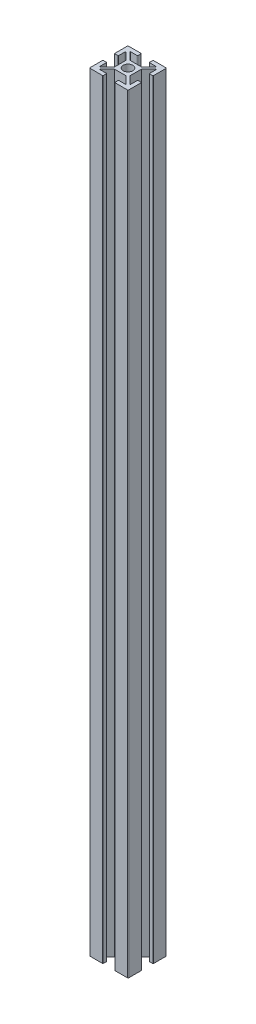
from build123d import *

# Parameters (mm, degrees)
SKETCH1_R           = 2.5
BOSS_EXTRUDE2_DEPTH = 400


with BuildPart() as part:
    # Sketch1 → Boss-Extrude2 (new body)
    with BuildSketch(Plane(origin=(0, 0, 0), x_dir=(1, 0, 0), z_dir=(0, 1, 0))):
        with BuildLine():
            Line((-9.896296296, 3), (-8.196296296, 3))
            ThreePointArc((-8.196296296, 3), (-8.090230279, 3.043933983), (-8.046296296, 3.15))
            Line((-8.046296296, 3.15), (-8.046296296, 6.586184513))
            ThreePointArc((-8.046296296, 6.586184513), (-7.954097251, 6.724600732), (-7.790842301, 6.692859041))
            Line((-7.790842301, 6.692859041), (-4, 2.945390222))
            Line((-4, 2.945390222), (-4, -2.945390222))
            Line((-4, -2.945390222), (-7.790842301, -6.692859041))
            ThreePointArc((-7.790842301, -6.692859041), (-7.954097251, -6.724600732), (-8.046296296, -6.586184513))
            Line((-8.046296296, -6.586184513), (-8.046296296, -3.15))
            ThreePointArc((-8.046296296, -3.15), (-8.090230279, -3.043933983), (-8.196296296, -3))
            Line((-8.196296296, -3), (-9.896296296, -3))
            ThreePointArc((-9.896296296, -3), (-10.002362313, -3.043933983), (-10.046296296, -3.15))
            Line((-10.046296296, -3.15), (-10.046296296, -9.65))
            ThreePointArc((-10.046296296, -9.65), (-9.94378367, -9.897487373), (-9.696296296, -10))
            Line((-9.696296296, -10), (-3.196296296, -10))
            ThreePointArc((-3.196296296, -10), (-3.090230279, -9.956066017), (-3.046296296, -9.85))
            Line((-3.046296296, -9.85), (-3.046296296, -8.15))
            ThreePointArc((-3.046296296, -8.15), (-3.090230279, -8.043933983), (-3.196296296, -8))
            Line((-3.196296296, -8), (-6.614381093, -8))
            ThreePointArc((-6.614381093, -8), (-6.753127587, -7.9070036), (-6.719835089, -7.743325472))
            Line((-6.719835089, -7.743325472), (-2.93318409, -4))
            Line((-2.93318409, -4), (2.93318409, -4))
            Line((2.93318409, -4), (6.719835089, -7.743325472))
            ThreePointArc((6.719835089, -7.743325472), (6.753127587, -7.9070036), (6.614381093, -8))
            Line((6.614381093, -8), (3.196296296, -8))
            ThreePointArc((3.196296296, -8), (3.090230279, -8.043933983), (3.046296296, -8.15))
            Line((3.046296296, -8.15), (3.046296296, -9.85))
            ThreePointArc((3.046296296, -9.85), (3.090230279, -9.956066017), (3.196296296, -10))
            Line((3.196296296, -10), (9.696296296, -10))
            ThreePointArc((9.696296296, -10), (9.94378367, -9.897487373), (10.046296296, -9.65))
            Line((10.046296296, -9.65), (10.046296296, -3.15))
            ThreePointArc((10.046296296, -3.15), (10.002362313, -3.043933983), (9.896296296, -3))
            Line((9.896296296, -3), (8.196296296, -3))
            ThreePointArc((8.196296296, -3), (8.090230279, -3.043933983), (8.046296296, -3.15))
            Line((8.046296296, -3.15), (8.046296296, -6.586184513))
            ThreePointArc((8.046296296, -6.586184513), (7.954097251, -6.724600732), (7.790842301, -6.692859041))
            Line((7.790842301, -6.692859041), (4, -2.945390222))
            Line((4, -2.945390222), (4, 2.945390222))
            Line((4, 2.945390222), (7.790842301, 6.692859041))
            ThreePointArc((7.790842301, 6.692859041), (7.954097251, 6.724600732), (8.046296296, 6.586184513))
            Line((8.046296296, 6.586184513), (8.046296296, 3.15))
            ThreePointArc((8.046296296, 3.15), (8.090230279, 3.043933983), (8.196296296, 3))
            Line((8.196296296, 3), (9.896296296, 3))
            ThreePointArc((9.896296296, 3), (10.002362313, 3.043933983), (10.046296296, 3.15))
            Line((10.046296296, 3.15), (10.046296296, 9.65))
            ThreePointArc((10.046296296, 9.65), (9.94378367, 9.897487373), (9.696296296, 10))
            Line((9.696296296, 10), (3.196296296, 10))
            ThreePointArc((3.196296296, 10), (3.090230279, 9.956066017), (3.046296296, 9.85))
            Line((3.046296296, 9.85), (3.046296296, 8.15))
            ThreePointArc((3.046296296, 8.15), (3.090230279, 8.043933983), (3.196296296, 8))
            Line((3.196296296, 8), (6.614381093, 8))
            ThreePointArc((6.614381093, 8), (6.753127587, 7.9070036), (6.719835089, 7.743325472))
            Line((6.719835089, 7.743325472), (2.93318409, 4))
            Line((2.93318409, 4), (-2.93318409, 4))
            Line((-2.93318409, 4), (-6.719835089, 7.743325472))
            ThreePointArc((-6.719835089, 7.743325472), (-6.753127587, 7.9070036), (-6.614381093, 8))
            Line((-6.614381093, 8), (-3.196296296, 8))
            ThreePointArc((-3.196296296, 8), (-3.090230279, 8.043933983), (-3.046296296, 8.15))
            Line((-3.046296296, 8.15), (-3.046296296, 9.85))
            ThreePointArc((-3.046296296, 9.85), (-3.090230279, 9.956066017), (-3.196296296, 10))
            Line((-3.196296296, 10), (-9.696296296, 10))
            ThreePointArc((-9.696296296, 10), (-9.94378367, 9.897487373), (-10.046296296, 9.65))
            Line((-10.046296296, 9.65), (-10.046296296, 3.15))
            ThreePointArc((-10.046296296, 3.15), (-10.002362313, 3.043933983), (-9.896296296, 3))
        make_face()
        with Locations(Location((0, 0, 0), (0, 0, 270))):
            Circle(SKETCH1_R, mode=Mode.SUBTRACT)
    extrude(amount=BOSS_EXTRUDE2_DEPTH)


solid = part.part
